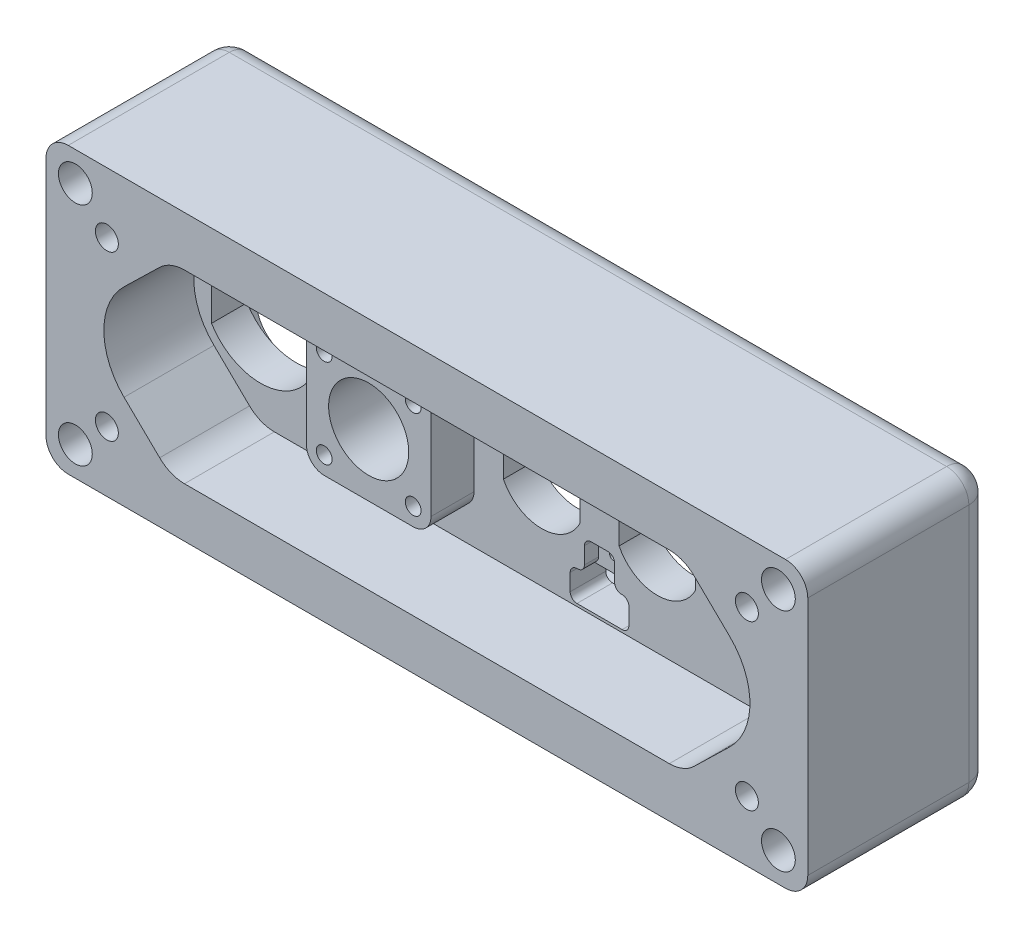
from build123d import *

# Parameters (mm, degrees)
SKETCH1_W                                            = 108.712
SKETCH1_H                                            = 40.64
BOSS_EXTRUDE1_DEPTH                                  = 26.162
CUT_EXTRUDE1_DEPTH                                   = 12.827
SKETCH3_R                                            = 5.715
CUT_EXTRUDE3_DEPTH                                   = 60.542416486
CUT_EXTRUDE4_DEPTH                                   = 60.542416486
LPATTERN1_COUNT                                      = 3
LPATTERN1_PITCH                                      = 16.51
F_1_4_0_25_DIAMETER_HOLE1_D                          = 4.826
F_1_4_0_25_DIAMETER_HOLE1_DEPTH                      = 3.81
F_1_4_0_25_DIAMETER_HOLE1_TIP                        = 1.449876674
CUT_EXTRUDE5_DEPTH                                   = 8.255
CBORE_FOR_1_4_BINDING_HEAD_MACHINE_SCREW_D           = 3.2766
CBORE_FOR_1_4_BINDING_HEAD_MACHINE_SCREW_CBORE_D     = 5.5626
CBORE_FOR_1_4_BINDING_HEAD_MACHINE_SCREW_CBORE_DEPTH = 2.8448
CUT_EXTRUDE6_DEPTH                                   = 60.542416486
CUT_EXTRUDE7_DEPTH                                   = 2.032
F_0_80_TAPPED_HOLE1_D                                = 1.19126
F_0_80_TAPPED_HOLE1_DEPTH                            = 1.524
F_0_80_TAPPED_HOLE1_TIP                              = 0.357890611
BOSS_EXTRUDE2_START                                  = 6.1468
SKETCH17_R                                           = 5.715
BOSS_EXTRUDE2_DEPTH                                  = 6.1468
F_4_40_TAPPED_HOLE4_D                                = 2.2606
F_4_40_TAPPED_HOLE4_DEPTH                            = 3.048
F_4_40_TAPPED_HOLE4_TIP                              = 0.679152758
CUT_EXTRUDE8_DEPTH                                   = 1.27
BOSS_EXTRUDE3_DEPTH                                  = 0.508
FILLET1_R                                            = 3.175


with BuildPart() as part:
    # Sketch1 → Boss-Extrude1 (new body)
    with BuildSketch(Plane.XY):
        Rectangle(SKETCH1_W, SKETCH1_H)
    extrude(amount=BOSS_EXTRUDE1_DEPTH)

    # Sketch2 → Cut-Extrude1 (cut)
    with BuildSketch(Plane.XY.offset(26.162)):
        with BuildLine():
            Line((-43.217293342, -6.827799627), (-38.136823116, -11.769493134))
            ThreePointArc((-38.136823116, -11.769493134), (-36.50629351, -12.834654073), (-34.5948, -13.208))
            Line((-34.5948, -13.208), (34.5948, -13.208))
            ThreePointArc((34.5948, -13.208), (36.50629351, -12.834654073), (38.136823116, -11.769493134))
            Line((38.136823116, -11.769493134), (43.217293342, -6.827799627))
            ThreePointArc((43.217293342, -6.827799627), (46.101, 0), (43.217293342, 6.827799627))
            Line((43.217293342, 6.827799627), (38.136823116, 11.769493134))
            ThreePointArc((38.136823116, 11.769493134), (36.50629351, 12.834654073), (34.5948, 13.208))
            Line((34.5948, 13.208), (-34.5948, 13.208))
            ThreePointArc((-34.5948, 13.208), (-36.50629351, 12.834654073), (-38.136823116, 11.769493134))
            Line((-38.136823116, 11.769493134), (-43.217293342, 6.827799627))
            ThreePointArc((-43.217293342, 6.827799627), (-46.101, 0), (-43.217293342, -6.827799627))
        make_face()
    extrude(amount=-CUT_EXTRUDE1_DEPTH, mode=Mode.SUBTRACT)

    # Sketch3 → Cut-Extrude3 (cut, through all)
    with BuildSketch(Plane.XY.offset(13.335)):
        with BuildLine():
            ThreePointArc((-29.591, 4.27907084), (-36.576, 8.1915), (-43.561, 4.27907084))
            Line((-43.561, 4.27907084), (-43.561, -4.27907084))
            ThreePointArc((-43.561, -4.27907084), (-36.576, -8.1915), (-29.591, -4.27907084))
            Line((-29.591, -4.27907084), (-29.591, 4.27907084))
        make_face()
        with Locations((-14.986, 0)):
            Circle(SKETCH3_R)
    extrude(amount=-CUT_EXTRUDE3_DEPTH, mode=Mode.SUBTRACT)

    # Sketch3<4> → Cut-Extrude4 (cut, through all)
    with BuildSketch(Plane.XY.offset(13.335)):
        with BuildLine():
            ThreePointArc((9.017, 2.709002584), (3.556, 6.096), (-1.905, 2.709002584))
            Line((-1.905, 2.709002584), (-1.905, -2.709002584))
            ThreePointArc((-1.905, -2.709002584), (3.556, -6.096), (9.017, -2.709002584))
            Line((9.017, -2.709002584), (9.017, 2.709002584))
        make_face()
    cut_extrude4 = extrude(amount=-CUT_EXTRUDE4_DEPTH, mode=Mode.SUBTRACT)

    # LPattern1: Cut-Extrude4 ×3
    with Locations(*[(i * LPATTERN1_PITCH, 0, 0) for i in range(1, LPATTERN1_COUNT)]):
        add(cut_extrude4, mode=Mode.SUBTRACT)

    # 1/4 (0.25) Diameter Hole1
    with Locations(Plane.XY.offset(26.162)):
        with Locations((-50.165, 16.129), (-50.165, -16.129), (50.165, -16.129), (50.165, 16.129)):
            Hole(F_1_4_0_25_DIAMETER_HOLE1_D / 2, depth=F_1_4_0_25_DIAMETER_HOLE1_DEPTH)
            with Locations((0, 0, -(F_1_4_0_25_DIAMETER_HOLE1_DEPTH + F_1_4_0_25_DIAMETER_HOLE1_TIP / 2))):  # 118° drill point
                Cone(0, F_1_4_0_25_DIAMETER_HOLE1_D / 2, F_1_4_0_25_DIAMETER_HOLE1_TIP, mode=Mode.SUBTRACT)

    # Sketch8 → Cut-Extrude5 (cut)
    with BuildSketch(Plane(origin=(0, 0, 0), x_dir=(-1, 0, 0), z_dir=(0, 0, -1))):
        with BuildLine():
            Line((-45.466, -16.51), (45.466, -16.51))
            ThreePointArc((45.466, -16.51), (49.058102448, -15.022102448), (50.546, -11.43))
            Line((50.546, -11.43), (50.546, 11.43))
            ThreePointArc((50.546, 11.43), (49.058102448, 15.022102448), (45.466, 16.51))
            Line((45.466, 16.51), (-45.466, 16.51))
            ThreePointArc((-45.466, 16.51), (-49.058102448, 15.022102448), (-50.546, 11.43))
            Line((-50.546, 11.43), (-50.546, -11.43))
            ThreePointArc((-50.546, -11.43), (-49.058102448, -15.022102448), (-45.466, -16.51))
        make_face()
    extrude(amount=-CUT_EXTRUDE5_DEPTH, mode=Mode.SUBTRACT)

    # CBORE for 1/4 Binding Head Machine Screw1 (through all)
    with Locations(Plane(origin=(0, 0, 8.255), x_dir=(-1, 0, 0), z_dir=(0, 0, -1))):
        with Locations((-45.6692, 11.684), (-45.6692, -11.684), (45.6692, -11.684), (45.6692, 11.684)):
            CounterBoreHole(CBORE_FOR_1_4_BINDING_HEAD_MACHINE_SCREW_D / 2, CBORE_FOR_1_4_BINDING_HEAD_MACHINE_SCREW_CBORE_D / 2, CBORE_FOR_1_4_BINDING_HEAD_MACHINE_SCREW_CBORE_DEPTH)

    # Sketch12 → Cut-Extrude6 (cut, through all)
    with BuildSketch(Plane.XY.offset(13.335)):
        with BuildLine():
            Line((15.0368, -8.509), (14.9352, -8.509))
            Line((14.9352, -8.509), (8.6868, -8.509))
            Line((8.6868, -8.509), (8.5852, -8.509))
            ThreePointArc((8.5852, -8.509), (7.902700535, -8.791700535), (7.62, -9.4742))
            Line((7.62, -9.4742), (7.62, -11.8618))
            ThreePointArc((7.62, -11.8618), (7.902700535, -12.544299465), (8.5852, -12.827))
            Line((8.5852, -12.827), (15.0368, -12.827))
            ThreePointArc((15.0368, -12.827), (15.719299465, -12.544299465), (16.002, -11.8618))
            Line((16.002, -11.8618), (16.002, -9.4742))
            ThreePointArc((16.002, -9.4742), (15.719299465, -8.791700535), (15.0368, -8.509))
        make_face()
    extrude(amount=-CUT_EXTRUDE6_DEPTH, mode=Mode.SUBTRACT)

    # Sketch12<3> → Cut-Extrude7 (cut)
    with BuildSketch(Plane.XY.offset(13.335)):
        with BuildLine():
            Line((8.6868, -8.509), (14.9352, -8.509))
            ThreePointArc((14.9352, -8.509), (14.252700535, -8.226299465), (13.97, -7.5438))
            Line((13.97, -7.5438), (13.97, -5.1562))
            ThreePointArc((13.97, -5.1562), (13.687299465, -4.473700535), (13.0048, -4.191))
            Line((13.0048, -4.191), (10.6172, -4.191))
            ThreePointArc((10.6172, -4.191), (9.934700535, -4.473700535), (9.652, -5.1562))
            Line((9.652, -5.1562), (9.652, -7.5438))
            ThreePointArc((9.652, -7.5438), (9.369299465, -8.226299465), (8.6868, -8.509))
        make_face()
    extrude(amount=-CUT_EXTRUDE7_DEPTH, mode=Mode.SUBTRACT)

    # #0-80 Tapped Hole1
    with Locations(Plane.XY.offset(11.303)):
        with Locations((11.811, -6.35)):
            Hole(F_0_80_TAPPED_HOLE1_D / 2, depth=F_0_80_TAPPED_HOLE1_DEPTH)
            with Locations((0, 0, -(F_0_80_TAPPED_HOLE1_DEPTH + F_0_80_TAPPED_HOLE1_TIP / 2))):  # 118° drill point
                Cone(0, F_0_80_TAPPED_HOLE1_D / 2, F_0_80_TAPPED_HOLE1_TIP, mode=Mode.SUBTRACT)

    # Sketch17 → Boss-Extrude2 (add)
    with BuildSketch(Plane.XY.offset(13.335).offset(BOSS_EXTRUDE2_START)):
        with BuildLine():
            Line((-21.336, -8.89), (-8.636, -8.89))
            ThreePointArc((-8.636, -8.89), (-6.839948776, -8.146051224), (-6.096, -6.35))
            Line((-6.096, -6.35), (-6.096, 6.35))
            ThreePointArc((-6.096, 6.35), (-6.839948776, 8.146051224), (-8.636, 8.89))
            Line((-8.636, 8.89), (-21.336, 8.89))
            ThreePointArc((-21.336, 8.89), (-23.132051224, 8.146051224), (-23.876, 6.35))
            Line((-23.876, 6.35), (-23.876, -6.35))
            ThreePointArc((-23.876, -6.35), (-23.132051224, -8.146051224), (-21.336, -8.89))
        make_face()
        with Locations((-14.986, 0)):
            Circle(SKETCH17_R, mode=Mode.SUBTRACT)
    extrude(amount=-BOSS_EXTRUDE2_DEPTH)

    # #4-40 Tapped Hole4
    with Locations(Plane.XY.offset(19.4818)):
        with Locations((-21.336, 6.35), (-8.636, 6.35), (-8.636, -6.35), (-21.336, -6.35)):
            Hole(F_4_40_TAPPED_HOLE4_D / 2, depth=F_4_40_TAPPED_HOLE4_DEPTH)
            with Locations((0, 0, -(F_4_40_TAPPED_HOLE4_DEPTH + F_4_40_TAPPED_HOLE4_TIP / 2))):  # 118° drill point
                Cone(0, F_4_40_TAPPED_HOLE4_D / 2, F_4_40_TAPPED_HOLE4_TIP, mode=Mode.SUBTRACT)

    # Sketch22 → Cut-Extrude8 (cut)
    with BuildSketch(Plane(origin=(0, 0, 8.255), x_dir=(-1, 0, 0), z_dir=(0, 0, -1))):
        with BuildLine():
            Line((-41.0464, 8.5852), (1.1684, 8.5852))
            ThreePointArc((1.1684, 8.5852), (2.317872783, 9.061327217), (2.794, 10.2108))
            Line((2.794, 10.2108), (2.794, 13.0048))
            ThreePointArc((2.794, 13.0048), (2.317872783, 14.154272783), (1.1684, 14.6304))
            Line((1.1684, 14.6304), (-41.0464, 14.6304))
            ThreePointArc((-41.0464, 14.6304), (-42.195872783, 14.154272783), (-42.672, 13.0048))
            Line((-42.672, 13.0048), (-42.672, 10.2108))
            ThreePointArc((-42.672, 10.2108), (-42.195872783, 9.061327217), (-41.0464, 8.5852))
        make_face()
    extrude(amount=-CUT_EXTRUDE8_DEPTH, mode=Mode.SUBTRACT)

    # Sketch23 → Boss-Extrude3 (add)
    # profile 1 of 11: a face of its own
    with BuildSketch(Plane(origin=(0, 0, 9.525), x_dir=(-1, 0, 0), z_dir=(0, 0, -1))):
        with BuildLine():
            Line((-40.979603187, 13.31666409), (-40.356941929, 13.31666409))
            add(Edge.make_bspline(
                [(-40.356941929, 13.31666409), (-40.314114893, 13.316617012), (-40.232056389, 13.31652681), (-40.114386303, 13.313792005), (-40.007516047, 13.31013922), (-39.911676058, 13.305075645), (-39.826571455, 13.299091596), (-39.752587333, 13.290698674), (-39.689142164, 13.281935406), (-39.651127028, 13.273025987), (-39.633789886, 13.268962767)],
                knots=[0, 0, 0, 0, 1.415646017, 2.712440637, 3.8905458, 4.950247383, 5.884950622, 6.709939814, 7.411656543, 8, 8, 8, 8], degree=3))
            add(Edge.make_bspline(
                [(-39.633789886, 13.268962767), (-39.611842895, 13.262955713), (-39.568466065, 13.251083153), (-39.505962976, 13.227303561), (-39.446496273, 13.199107597), (-39.389861931, 13.166973023), (-39.336755899, 13.129521118), (-39.286385847, 13.08827005), (-39.239196294, 13.042267413), (-39.195452602, 12.992029171), (-39.155279965, 12.938398695), (-39.120690895, 12.880575386), (-39.091728339, 12.819532561), (-39.0668878, 12.755312678), (-39.049009417, 12.687376456), (-39.035541157, 12.616195939), (-39.026992581, 12.541778755), (-39.026173829, 12.490924447), (-39.025757033, 12.465036485)],
                knots=[0, 0, 0, 0, 0.999701418, 1.975846123, 2.934577507, 3.890451536, 4.834027766, 5.787354733, 6.749476667, 7.726910423, 8.712836071, 9.690891519, 10.682875813, 11.679750201, 12.712814741, 13.765529915, 14.8625177, 16, 16, 16, 16], degree=3))
            add(Edge.make_bspline(
                [(-39.025757033, 12.465036485), (-39.026139326, 12.438930931), (-39.026887307, 12.38785365), (-39.035864651, 12.313129763), (-39.047957039, 12.241720938), (-39.066550794, 12.173785508), (-39.090903655, 12.109726916), (-39.119471445, 12.048566227), (-39.153927934, 11.991343953), (-39.193520029, 11.937852354), (-39.237563261, 11.888041219), (-39.285871284, 11.842271513), (-39.33824907, 11.800811149), (-39.394530162, 11.76356718), (-39.455263239, 11.731403269), (-39.519527193, 11.702594857), (-39.587880603, 11.678400395), (-39.635181312, 11.665673125), (-39.659230591, 11.65920215)],
                knots=[0, 0, 0, 0, 1.121902311, 2.195077645, 3.232258892, 4.234102512, 5.217864754, 6.176164875, 7.132989551, 8.084763148, 9.034132444, 9.988522005, 10.94243251, 11.903244335, 12.886203696, 13.894208494, 14.929344452, 16, 16, 16, 16], degree=3))
            add(Edge.make_bspline(
                [(-39.659230591, 11.65920215), (-39.679121815, 11.654972161), (-39.72271459, 11.645701892), (-39.794508345, 11.635352791), (-39.878097374, 11.626519396), (-39.973367585, 11.619896222), (-40.080233463, 11.614226245), (-40.198752818, 11.609719474), (-40.329158302, 11.607243106), (-40.420118645, 11.607115387), (-40.467608996, 11.607048705)],
                knots=[0, 0, 0, 0, 0.601384939, 1.31797006, 2.144135048, 3.087295005, 4.142315834, 5.309527816, 6.595305764, 8, 8, 8, 8], degree=3))
            Line((-40.467608996, 11.607048705), (-40.69466729, 11.607048705))
            Line((-40.69466729, 11.607048705), (-40.69466729, 10.14166409))
            Line((-40.69466729, 10.14166409), (-40.979603187, 10.14166409))
            Line((-40.979603187, 10.14166409), (-40.979603187, 13.31666409))
        make_face()
        with BuildLine():
            Line((-40.69466729, 12.991023064), (-40.69466729, 11.932689731))
            Line((-40.69466729, 11.932689731), (-40.138787883, 11.925693537))
            add(Edge.make_bspline(
                [(-40.138787883, 11.925693537), (-40.111646236, 11.925679509), (-40.059249846, 11.925652429), (-39.983561272, 11.929267596), (-39.91333999, 11.933440936), (-39.848801696, 11.939551381), (-39.789917299, 11.948188522), (-39.736588612, 11.956907741), (-39.689229148, 11.969521892), (-39.633803444, 11.98650639), (-39.572042121, 12.015473834), (-39.504852274, 12.057519806), (-39.447910385, 12.111114448), (-39.39863593, 12.171373981), (-39.35953274, 12.238411048), (-39.330906947, 12.31013787), (-39.314087469, 12.385818847), (-39.311832136, 12.437605945), (-39.310692931, 12.46376445)],
                knots=[0, 0, 0, 0, 1.160613943, 2.240541288, 3.23993089, 4.169200891, 5.011653406, 5.7853311, 6.478053781, 7.106038997, 8.262395093, 9.384106736, 10.481365981, 11.59014053, 12.70357646, 13.786202915, 14.881775077, 16, 16, 16, 16], degree=3))
            add(Edge.make_bspline(
                [(-39.310692931, 12.46376445), (-39.311838332, 12.489290102), (-39.314115246, 12.540031938), (-39.331038779, 12.614398385), (-39.359477086, 12.685369345), (-39.398898425, 12.751566358), (-39.446742164, 12.811609059), (-39.502349426, 12.863767167), (-39.565589313, 12.905696855), (-39.624415922, 12.932759903), (-39.676668427, 12.94928376), (-39.722054562, 12.960845151), (-39.773299674, 12.970075879), (-39.830420445, 12.977550286), (-39.892974144, 12.983948783), (-39.961498187, 12.988290348), (-40.035732992, 12.990831669), (-40.087268296, 12.990957721), (-40.113983195, 12.991023064)],
                knots=[0, 0, 0, 0, 1.120700087, 2.227813068, 3.331159281, 4.466773991, 5.599788987, 6.693661531, 7.80175334, 8.91857717, 9.525282508, 10.207424825, 10.974604443, 11.810962634, 12.737642355, 13.736264703, 14.826523623, 16, 16, 16, 16], degree=3))
            Line((-40.113983195, 12.991023064), (-40.69466729, 12.991023064))
        make_face(mode=Mode.SUBTRACT)
    # profile 2 of 11: a face of its own
    with BuildSketch(Plane(origin=(0, 0, 9.525), x_dir=(-1, 0, 0), z_dir=(0, 0, -1))):
        Polygon((-38.578000623, 13.31666409), (-38.283524461, 13.31666409), (-37.662135238, 10.988203553), (-36.738001625, 13.31666409), (-36.696660479, 13.31666409), (-35.789699341, 11.004103993), (-35.16513003, 13.31666409), (-34.873833956, 13.31666409), (-35.729913684, 10.14166409), (-35.770618812, 10.14166409), (-36.72591729, 12.569979394), (-37.692664085, 10.14166409), (-37.733369213, 10.14166409), align=None)
    # profile 3 of 11: a face of its own
    with BuildSketch(Plane(origin=(0, 0, 9.525), x_dir=(-1, 0, 0), z_dir=(0, 0, -1))):
        with BuildLine():
            Line((-34.303962162, 13.31666409), (-33.668580551, 13.31666409))
            add(Edge.make_bspline(
                [(-33.668580551, 13.31666409), (-33.62617967, 13.316522951), (-33.544765282, 13.316251949), (-33.428130958, 13.314740864), (-33.322152092, 13.310409841), (-33.226884094, 13.306682769), (-33.142328715, 13.299886508), (-33.068226672, 13.293390778), (-33.004919261, 13.284887529), (-32.966596239, 13.276990467), (-32.949244613, 13.273414891)],
                knots=[0, 0, 0, 0, 1.410062039, 2.707475311, 3.878576406, 4.937260626, 5.877586885, 6.699081471, 7.410979367, 8, 8, 8, 8], degree=3))
            add(Edge.make_bspline(
                [(-32.949244613, 13.273414891), (-32.926015747, 13.267675611), (-32.88005355, 13.256319485), (-32.813877418, 13.232316847), (-32.750817996, 13.204540474), (-32.691137227, 13.171916242), (-32.635134045, 13.134201977), (-32.582231006, 13.092048752), (-32.53218805, 13.045687215), (-32.487028999, 12.993948466), (-32.444448574, 12.939668204), (-32.408536034, 12.880972653), (-32.377578442, 12.819593981), (-32.352930901, 12.754907967), (-32.333084454, 12.687541931), (-32.319090651, 12.616885665), (-32.310698502, 12.543261066), (-32.309844105, 12.493043535), (-32.30941088, 12.467580556)],
                knots=[0, 0, 0, 0, 1.027469482, 2.033020251, 3.019912614, 3.986113645, 4.951240523, 5.91722682, 6.890402269, 7.87763091, 8.8651537, 9.85103654, 10.82876324, 11.815024772, 12.821070561, 13.842952187, 14.906261191, 16, 16, 16, 16], degree=3))
            add(Edge.make_bspline(
                [(-32.30941088, 12.467580556), (-32.310743471, 12.425275854), (-32.313343701, 12.342728423), (-32.337587188, 12.222930338), (-32.377298745, 12.111180031), (-32.432020586, 12.007618209), (-32.501706825, 11.914263552), (-32.585458599, 11.832266497), (-32.683322633, 11.76365029), (-32.774426369, 11.716068103), (-32.854902822, 11.685594536), (-32.92115447, 11.664152982), (-32.993423799, 11.64758677), (-33.071018382, 11.632745794), (-33.154261126, 11.621541042), (-33.242952519, 11.613334489), (-33.337155814, 11.608205459), (-33.401870541, 11.60744164), (-33.435162081, 11.607048705)],
                knots=[0, 0, 0, 0, 1.260483769, 2.459530307, 3.627416485, 4.787058657, 5.939039949, 7.08810263, 8.267026773, 9.491475466, 10.141966685, 10.831826277, 11.566392101, 12.351337768, 13.187381173, 14.07005841, 15.007169909, 16, 16, 16, 16], degree=3))
            Line((-33.435162081, 11.607048705), (-32.268705751, 10.14166409))
            Line((-32.268705751, 10.14166409), (-32.621059517, 10.14166409))
            Line((-32.621059517, 10.14166409), (-33.787515847, 11.607048705))
            Line((-33.787515847, 11.607048705), (-34.019026264, 11.607048705))
            Line((-34.019026264, 11.607048705), (-34.019026264, 10.14166409))
            Line((-34.019026264, 10.14166409), (-34.303962162, 10.14166409))
            Line((-34.303962162, 10.14166409), (-34.303962162, 13.31666409))
        make_face()
        with BuildLine():
            Line((-34.019026264, 12.991023064), (-34.019026264, 11.932689731))
            Line((-34.019026264, 11.932689731), (-33.437706152, 11.928237607))
            add(Edge.make_bspline(
                [(-33.437706152, 11.928237607), (-33.410564402, 11.9282256), (-33.357955961, 11.928202326), (-33.281846072, 11.931825251), (-33.210979971, 11.93594669), (-33.145628717, 11.942250739), (-33.085763117, 11.950375176), (-33.031413092, 11.960537883), (-32.982489924, 11.972377968), (-32.925431964, 11.990703729), (-32.861717396, 12.01973776), (-32.792473857, 12.061979319), (-32.733507451, 12.115109877), (-32.683689104, 12.175864369), (-32.643657406, 12.242662967), (-32.615434328, 12.314704959), (-32.597525113, 12.390171623), (-32.595412789, 12.442040335), (-32.594346777, 12.468216574)],
                knots=[0, 0, 0, 0, 1.146690395, 2.22261258, 3.21895312, 4.145990853, 4.996080663, 5.770904154, 6.481378293, 7.121626537, 8.300444488, 9.431385265, 10.535395872, 11.636531494, 12.74115979, 13.810798291, 14.895190096, 16, 16, 16, 16], degree=3))
            add(Edge.make_bspline(
                [(-32.594346777, 12.468216574), (-32.595437272, 12.493749537), (-32.597598237, 12.544346553), (-32.615241048, 12.618420129), (-32.645076416, 12.688330862), (-32.685283017, 12.75379436), (-32.734267965, 12.81321742), (-32.791706266, 12.864060195), (-32.856027408, 12.906015066), (-32.916144852, 12.932825111), (-32.969878745, 12.949262407), (-33.016532793, 12.960829534), (-33.069248205, 12.970122731), (-33.128280943, 12.977568614), (-33.193378994, 12.983968457), (-33.264871513, 12.988278999), (-33.342284163, 12.990831576), (-33.39593888, 12.990957749), (-33.423713764, 12.991023064)],
                knots=[0, 0, 0, 0, 1.101028733, 2.181837193, 3.264309656, 4.369019818, 5.486613113, 6.575447106, 7.666700264, 8.788928104, 9.402425223, 10.0903467, 10.862060571, 11.710948788, 12.657782767, 13.684531032, 14.801375019, 16, 16, 16, 16], degree=3))
            Line((-33.423713764, 12.991023064), (-34.019026264, 12.991023064))
        make_face(mode=Mode.SUBTRACT)
    # profile 4 of 11: a face of its own
    with BuildSketch(Plane(origin=(0, 0, 9.525), x_dir=(-1, 0, 0), z_dir=(0, 0, -1))):
        Polygon((-24.209090367, 13.31666409), (-22.743705751, 10.14166409), (-23.053446336, 10.14166409), (-23.522827346, 11.159292295), (-24.962135238, 11.159292295), (-25.444872618, 10.14166409), (-25.755885238, 10.14166409), (-24.249795495, 13.31666409), align=None)
        Polygon((-24.232623019, 12.697818937), (-24.807582955, 11.48493332), (-23.672927506, 11.48493332), align=None, mode=Mode.SUBTRACT)
    # profile 5 of 11: a face of its own
    with BuildSketch(Plane(origin=(0, 0, 9.525), x_dir=(-1, 0, 0), z_dir=(0, 0, -1))):
        with BuildLine():
            Line((-22.173833956, 13.31666409), (-21.888898059, 13.31666409))
            Line((-21.888898059, 13.31666409), (-21.888898059, 11.414335364))
            add(Edge.make_bspline(
                [(-21.888898059, 11.414335364), (-21.888940462, 11.387410696), (-21.88902093, 11.3363165), (-21.888483436, 11.263592399), (-21.886978151, 11.198938097), (-21.886029135, 11.142104374), (-21.883917911, 11.093352025), (-21.882196112, 11.052416921), (-21.879982178, 11.019492895), (-21.877321421, 11.000278769), (-21.876177706, 10.992019658)],
                knots=[0, 0, 0, 0, 1.528628734, 2.90083645, 4.128790002, 5.200304208, 6.127813768, 6.898992206, 7.526736466, 8, 8, 8, 8], degree=3))
            add(Edge.make_bspline(
                [(-21.876177706, 10.992019658), (-21.871481012, 10.962222952), (-21.862352264, 10.904308476), (-21.839087336, 10.821841677), (-21.806595745, 10.74751814), (-21.768093842, 10.679018612), (-21.717354974, 10.618249693), (-21.656573195, 10.562268407), (-21.582933362, 10.51330827), (-21.501054099, 10.468540034), (-21.41280249, 10.432558138), (-21.32262227, 10.405349872), (-21.231868996, 10.388768298), (-21.171112046, 10.386848295), (-21.140941328, 10.385894859)],
                knots=[0, 0, 0, 0, 1.035780045, 2.013197591, 2.933192213, 3.817615948, 4.702609284, 5.640816605, 6.646850145, 7.73207398, 8.84249596, 9.914020372, 10.964143139, 12, 12, 12, 12], degree=3))
            add(Edge.make_bspline(
                [(-21.140941328, 10.385894859), (-21.115039007, 10.386868994), (-21.063383968, 10.388811639), (-20.986633849, 10.400841652), (-20.911885179, 10.422522879), (-20.838768848, 10.450498946), (-20.770233312, 10.487462832), (-20.706240333, 10.530162808), (-20.649123049, 10.58024696), (-20.597000437, 10.635673701), (-20.551611602, 10.698211948), (-20.512267781, 10.766499973), (-20.480040688, 10.841565452), (-20.464126205, 10.894319821), (-20.455950343, 10.921421702)],
                knots=[0, 0, 0, 0, 0.994687771, 1.983630487, 2.973142513, 3.978332533, 4.983357753, 5.956394766, 6.925816176, 7.893390482, 8.871859704, 9.88551698, 10.913711441, 12, 12, 12, 12], degree=3))
            add(Edge.make_bspline(
                [(-20.455950343, 10.921421702), (-20.4532288, 10.932623623), (-20.447164108, 10.957586017), (-20.441497145, 10.999787474), (-20.435594797, 11.049579968), (-20.431499437, 11.107321255), (-20.427506902, 11.172817852), (-20.425118328, 11.246410957), (-20.424014306, 11.327833343), (-20.423685303, 11.384654197), (-20.423513444, 11.414335364)],
                knots=[0, 0, 0, 0, 0.558680831, 1.244966039, 2.062412453, 2.990489873, 4.051219941, 5.244515665, 6.560634259, 8, 8, 8, 8], degree=3))
            Line((-20.423513444, 11.414335364), (-20.423513444, 13.31666409))
            Line((-20.423513444, 13.31666409), (-20.138577546, 13.31666409))
            Line((-20.138577546, 13.31666409), (-20.138577546, 11.399070941))
            add(Edge.make_bspline(
                [(-20.138577546, 11.399070941), (-20.13880807, 11.364510268), (-20.13925795, 11.297063015), (-20.143159188, 11.198228568), (-20.149379466, 11.104472649), (-20.158167946, 11.015782656), (-20.169812941, 10.932475954), (-20.182762606, 10.853822343), (-20.199254039, 10.780386414), (-20.218515768, 10.711595578), (-20.240535343, 10.646113005), (-20.269056956, 10.583965905), (-20.301192039, 10.523264985), (-20.339305331, 10.464928343), (-20.382132799, 10.408697684), (-20.43062111, 10.354914023), (-20.483166599, 10.302717889), (-20.54064277, 10.253448179), (-20.602102176, 10.208264593), (-20.667361994, 10.168533758), (-20.735920921, 10.134948048), (-20.807600743, 10.107302031), (-20.882432048, 10.086515216), (-20.960416724, 10.07102561), (-21.041732278, 10.06222424), (-21.097035931, 10.060916204), (-21.125040888, 10.060253833)],
                knots=[0, 0, 0, 0, 1.316592851, 2.569410997, 3.76748051, 4.895814652, 5.963796859, 6.97159953, 7.931736103, 8.829262218, 9.692595152, 10.560224239, 11.431080259, 12.30701507, 13.211635791, 14.121146779, 15.063487852, 16.031507147, 17.00238618, 17.966455255, 18.938106653, 19.907068911, 20.888905087, 21.893141452, 22.933117798, 24, 24, 24, 24], degree=3))
            add(Edge.make_bspline(
                [(-21.125040888, 10.060253833), (-21.155583573, 10.060965727), (-21.215508214, 10.062362461), (-21.303807746, 10.070365956), (-21.388457053, 10.085441214), (-21.47035017, 10.104636306), (-21.548372164, 10.131110124), (-21.62356836, 10.162041995), (-21.694650878, 10.200030652), (-21.762772887, 10.242297516), (-21.826113916, 10.289854152), (-21.884259418, 10.341688453), (-21.937305386, 10.396970081), (-21.984357703, 10.456297555), (-22.026195934, 10.519209461), (-22.062236914, 10.585883771), (-22.093182499, 10.656294673), (-22.109154171, 10.705237933), (-22.117228388, 10.729980396)],
                knots=[0, 0, 0, 0, 1.13879206, 2.234305948, 3.301075583, 4.341971843, 5.366689343, 6.369221514, 7.369726634, 8.367512178, 9.355451585, 10.318319045, 11.268648973, 12.207971039, 13.137398894, 14.081662264, 15.030215811, 16, 16, 16, 16], degree=3))
            add(Edge.make_bspline(
                [(-22.117228388, 10.729980396), (-22.12192481, 10.746882802), (-22.132111454, 10.783544499), (-22.143020116, 10.8442201), (-22.152190498, 10.914083632), (-22.160813397, 10.993139879), (-22.165901523, 11.081450115), (-22.170362342, 11.17897606), (-22.173865382, 11.28583564), (-22.173844725, 11.360270807), (-22.173833956, 11.399070941)],
                knots=[0, 0, 0, 0, 0.625038921, 1.35572334, 2.194682327, 3.136881307, 4.189498639, 5.346923369, 6.617055217, 8, 8, 8, 8], degree=3))
            Line((-22.173833956, 11.399070941), (-22.173833956, 13.31666409))
        make_face()
    # profile 6 of 11: a face of its own
    with BuildSketch(Plane(origin=(0, 0, 9.525), x_dir=(-1, 0, 0), z_dir=(0, 0, -1))):
        with BuildLine():
            Line((-19.324474982, 10.14166409), (-19.324474982, 13.31666409))
            Line((-19.324474982, 13.31666409), (-18.683369213, 13.31666409))
            add(Edge.make_bspline(
                [(-18.683369213, 13.31666409), (-18.627608059, 13.316262615), (-18.519877801, 13.315486969), (-18.364200795, 13.310568993), (-18.220161239, 13.30186907), (-18.08823286, 13.289196715), (-17.968053474, 13.273636463), (-17.859959594, 13.254132524), (-17.763392293, 13.231101827), (-17.704002158, 13.211466311), (-17.67591729, 13.202180917)],
                knots=[0, 0, 0, 0, 1.314313732, 2.53924729, 3.670748893, 4.714932338, 5.66265055, 6.526160246, 7.303039223, 8, 8, 8, 8], degree=3))
            add(Edge.make_bspline(
                [(-17.67591729, 13.202180917), (-17.639182776, 13.188183062), (-17.566546766, 13.160504778), (-17.463126019, 13.108292991), (-17.365766583, 13.049135391), (-17.273946359, 12.982954001), (-17.189762752, 12.907874914), (-17.109927017, 12.827087415), (-17.037705089, 12.737653706), (-16.971566849, 12.641428538), (-16.911935215, 12.539545462), (-16.860101836, 12.432198614), (-16.817054285, 12.319933147), (-16.781319001, 12.203061262), (-16.753155429, 12.081325977), (-16.733940391, 11.954585541), (-16.721266707, 11.823340848), (-16.719993032, 11.734282584), (-16.719346777, 11.689094979)],
                knots=[0, 0, 0, 0, 0.984719456, 1.947108742, 2.898477687, 3.838006223, 4.779231079, 5.722358779, 6.681677486, 7.655904652, 8.64651281, 9.637519902, 10.640069247, 11.656948941, 12.698408672, 13.768548281, 14.867775369, 16, 16, 16, 16], degree=3))
            add(Edge.make_bspline(
                [(-16.719346777, 11.689094979), (-16.71991734, 11.649850856), (-16.721041695, 11.572516211), (-16.731137574, 11.45854197), (-16.745811808, 11.347948945), (-16.768530473, 11.241263774), (-16.796109896, 11.137551748), (-16.831455947, 11.037918212), (-16.871946719, 10.941449185), (-16.919163394, 10.849449046), (-16.970998794, 10.762287701), (-17.026626375, 10.680122758), (-17.085986806, 10.604126664), (-17.14964613, 10.53406928), (-17.216781701, 10.470056219), (-17.287833058, 10.411552748), (-17.36298354, 10.359703588), (-17.441896553, 10.312471283), (-17.526874184, 10.271268532), (-17.619526006, 10.236407023), (-17.720247146, 10.207517593), (-17.828790378, 10.183413995), (-17.945343247, 10.16429387), (-18.070020023, 10.151479214), (-18.20262915, 10.142813339), (-18.293687484, 10.142054611), (-18.340555711, 10.14166409)],
                knots=[0, 0, 0, 0, 1.105936401, 2.179363191, 3.223086493, 4.248585256, 5.251745608, 6.245858792, 7.225916811, 8.198733463, 9.158002045, 10.082870192, 10.993790845, 11.873723703, 12.748670949, 13.606408763, 14.465103618, 15.319838547, 16.196477973, 17.123216899, 18.106603292, 19.147568657, 20.255746949, 21.433717677, 22.679120308, 24, 24, 24, 24], degree=3))
            Line((-18.340555711, 10.14166409), (-19.324474982, 10.14166409))
        make_face()
        with BuildLine():
            Line((-19.039539085, 10.467305115), (-18.675100984, 10.467305115))
            add(Edge.make_bspline(
                [(-18.675100984, 10.467305115), (-18.622733104, 10.467530174), (-18.522010495, 10.467963045), (-18.377177883, 10.471761436), (-18.24484443, 10.477968051), (-18.124991347, 10.486654014), (-18.017686303, 10.498146258), (-17.922705044, 10.510959563), (-17.840358917, 10.526922964), (-17.790530071, 10.541392763), (-17.767503828, 10.548079354)],
                knots=[0, 0, 0, 0, 1.375205317, 2.645023457, 3.804390687, 4.853969522, 5.800190428, 6.637939096, 7.370582563, 8, 8, 8, 8], degree=3))
            add(Edge.make_bspline(
                [(-17.767503828, 10.548079354), (-17.7385221, 10.558286125), (-17.681250871, 10.578455878), (-17.598808744, 10.61524747), (-17.521922032, 10.658828491), (-17.449250795, 10.707271982), (-17.3818259, 10.76228657), (-17.318848309, 10.822675967), (-17.260444818, 10.888747513), (-17.207218839, 10.960419202), (-17.159586306, 11.037244945), (-17.118337405, 11.118469459), (-17.082186372, 11.203202779), (-17.053812221, 11.292746087), (-17.031573083, 11.386298876), (-17.015820831, 11.483867727), (-17.006010331, 11.585434418), (-17.004866017, 11.654515274), (-17.004282674, 11.689730997)],
                knots=[0, 0, 0, 0, 0.998632004, 1.973411704, 2.929992603, 3.868527914, 4.809262121, 5.754881198, 6.702106254, 7.672490631, 8.653608572, 9.636854334, 10.631411391, 11.644891563, 12.686317036, 13.754757253, 14.855430412, 16, 16, 16, 16], degree=3))
            add(Edge.make_bspline(
                [(-17.004282674, 11.689730997), (-17.004748299, 11.726863511), (-17.005663024, 11.799810664), (-17.017160434, 11.90684508), (-17.033962131, 12.009788242), (-17.05825876, 12.108647033), (-17.089220343, 12.203614324), (-17.127859768, 12.29416488), (-17.172007344, 12.381255011), (-17.224533943, 12.462874614), (-17.282060945, 12.54006622), (-17.345903736, 12.610782465), (-17.415048013, 12.675184438), (-17.488739627, 12.7342751), (-17.569055424, 12.785677149), (-17.654103415, 12.831657209), (-17.745131274, 12.870678768), (-17.808461362, 12.891433165), (-17.840645855, 12.901980596)],
                knots=[0, 0, 0, 0, 1.122418816, 2.205001699, 3.251619955, 4.274784885, 5.280384055, 6.268708349, 7.249350384, 8.229342522, 9.199999885, 10.157847722, 11.105861043, 12.055065948, 13.010012805, 13.98527497, 14.976112212, 16, 16, 16, 16], degree=3))
            add(Edge.make_bspline(
                [(-17.840645855, 12.901980596), (-17.867271538, 12.909343356), (-17.923885045, 12.924998603), (-18.016267988, 12.942075905), (-18.120240302, 12.957138557), (-18.236263602, 12.969891207), (-18.364205633, 12.979041849), (-18.504164792, 12.985910113), (-18.656201577, 12.990542558), (-18.761595732, 12.990858885), (-18.816296897, 12.991023064)],
                knots=[0, 0, 0, 0, 0.674548936, 1.434276114, 2.292660221, 3.240891867, 4.284742987, 5.42552168, 6.663806718, 8, 8, 8, 8], degree=3))
            Line((-18.816296897, 12.991023064), (-19.039539085, 12.991023064))
            Line((-19.039539085, 12.991023064), (-19.039539085, 10.467305115))
        make_face(mode=Mode.SUBTRACT)
    # profile 7 of 11: a face of its own
    with BuildSketch(Plane(origin=(0, 0, 9.525), x_dir=(-1, 0, 0), z_dir=(0, 0, -1))):
        Polygon((-15.67818592, 13.31666409), (-15.091141649, 13.31666409), (-15.091141649, 10.14166409), (-15.376077546, 10.14166409), (-15.376077546, 12.991023064), (-15.864539085, 12.991023064), align=None)
    # profile 8 of 11: a face of its own
    with BuildSketch(Plane(origin=(0, 0, 9.525), x_dir=(-1, 0, 0), z_dir=(0, 0, -1))):
        Polygon((-8.659731392, 13.31666409), (-7.194346777, 10.14166409), (-7.504087362, 10.14166409), (-7.973468371, 11.159292295), (-9.412776264, 11.159292295), (-9.895513644, 10.14166409), (-10.206526264, 10.14166409), (-8.700436521, 13.31666409), align=None)
        Polygon((-8.683264045, 12.697818937), (-9.25822398, 11.48493332), (-8.123568532, 11.48493332), align=None, mode=Mode.SUBTRACT)
    # profile 9 of 11: a face of its own
    with BuildSketch(Plane(origin=(0, 0, 9.525), x_dir=(-1, 0, 0), z_dir=(0, 0, -1))):
        with BuildLine():
            Line((-6.624474982, 13.31666409), (-6.339539085, 13.31666409))
            Line((-6.339539085, 13.31666409), (-6.339539085, 11.414335364))
            add(Edge.make_bspline(
                [(-6.339539085, 11.414335364), (-6.339581488, 11.387410696), (-6.339661956, 11.3363165), (-6.339124461, 11.263592399), (-6.337619177, 11.198938097), (-6.336670161, 11.142104374), (-6.334558937, 11.093352025), (-6.332837137, 11.052416921), (-6.330623204, 11.019492895), (-6.327962447, 11.000278769), (-6.326818732, 10.992019658)],
                knots=[0, 0, 0, 0, 1.528628734, 2.90083645, 4.128790002, 5.200304208, 6.127813768, 6.898992206, 7.526736466, 8, 8, 8, 8], degree=3))
            add(Edge.make_bspline(
                [(-6.326818732, 10.992019658), (-6.322122037, 10.962222952), (-6.31299329, 10.904308476), (-6.289728361, 10.821841677), (-6.257236771, 10.74751814), (-6.218734868, 10.679018612), (-6.167995999, 10.618249693), (-6.107214221, 10.562268407), (-6.033574388, 10.51330827), (-5.951695124, 10.468540034), (-5.863443516, 10.432558138), (-5.773263296, 10.405349872), (-5.682510022, 10.388768298), (-5.621753072, 10.386848295), (-5.591582354, 10.385894859)],
                knots=[0, 0, 0, 0, 1.035780045, 2.013197591, 2.933192213, 3.817615948, 4.702609284, 5.640816605, 6.646850145, 7.73207398, 8.84249596, 9.914020372, 10.964143139, 12, 12, 12, 12], degree=3))
            add(Edge.make_bspline(
                [(-5.591582354, 10.385894859), (-5.565680032, 10.386868994), (-5.514024994, 10.388811639), (-5.437274875, 10.400841652), (-5.362526205, 10.422522879), (-5.289409874, 10.450498946), (-5.220874338, 10.487462832), (-5.156881358, 10.530162808), (-5.099764075, 10.58024696), (-5.047641463, 10.635673701), (-5.002252628, 10.698211948), (-4.962908807, 10.766499973), (-4.930681713, 10.841565452), (-4.91476723, 10.894319821), (-4.906591368, 10.921421702)],
                knots=[0, 0, 0, 0, 0.994687771, 1.983630487, 2.973142513, 3.978332533, 4.983357753, 5.956394766, 6.925816176, 7.893390482, 8.871859704, 9.88551698, 10.913711441, 12, 12, 12, 12], degree=3))
            add(Edge.make_bspline(
                [(-4.906591368, 10.921421702), (-4.903869826, 10.932623623), (-4.897805133, 10.957586017), (-4.892138171, 10.999787474), (-4.886235823, 11.049579968), (-4.882140463, 11.107321255), (-4.878147927, 11.172817852), (-4.875759354, 11.246410957), (-4.874655331, 11.327833343), (-4.874326329, 11.384654197), (-4.874154469, 11.414335364)],
                knots=[0, 0, 0, 0, 0.558680831, 1.244966039, 2.062412453, 2.990489873, 4.051219941, 5.244515665, 6.560634259, 8, 8, 8, 8], degree=3))
            Line((-4.874154469, 11.414335364), (-4.874154469, 13.31666409))
            Line((-4.874154469, 13.31666409), (-4.589218572, 13.31666409))
            Line((-4.589218572, 13.31666409), (-4.589218572, 11.399070941))
            add(Edge.make_bspline(
                [(-4.589218572, 11.399070941), (-4.589449095, 11.364510268), (-4.589898976, 11.297063015), (-4.593800213, 11.198228568), (-4.600020492, 11.104472649), (-4.608808971, 11.015782656), (-4.620453967, 10.932475954), (-4.633403631, 10.853822343), (-4.649895065, 10.780386414), (-4.669156793, 10.711595578), (-4.691176369, 10.646113005), (-4.719697982, 10.583965905), (-4.751833064, 10.523264985), (-4.789946356, 10.464928343), (-4.832773825, 10.408697684), (-4.881262135, 10.354914023), (-4.933807624, 10.302717889), (-4.991283796, 10.253448179), (-5.052743201, 10.208264593), (-5.11800302, 10.168533758), (-5.186561947, 10.134948048), (-5.258241768, 10.107302031), (-5.333073074, 10.086515216), (-5.41105775, 10.07102561), (-5.492373304, 10.06222424), (-5.547676956, 10.060916204), (-5.575681913, 10.060253833)],
                knots=[0, 0, 0, 0, 1.316592851, 2.569410997, 3.76748051, 4.895814652, 5.963796859, 6.97159953, 7.931736103, 8.829262218, 9.692595152, 10.560224239, 11.431080259, 12.30701507, 13.211635791, 14.121146779, 15.063487852, 16.031507147, 17.00238618, 17.966455255, 18.938106653, 19.907068911, 20.888905087, 21.893141452, 22.933117798, 24, 24, 24, 24], degree=3))
            add(Edge.make_bspline(
                [(-5.575681913, 10.060253833), (-5.606224599, 10.060965727), (-5.66614924, 10.062362461), (-5.754448772, 10.070365956), (-5.839098079, 10.085441214), (-5.920991196, 10.104636306), (-5.99901319, 10.131110124), (-6.074209386, 10.162041995), (-6.145291903, 10.200030652), (-6.213413913, 10.242297516), (-6.276754942, 10.289854152), (-6.334900443, 10.341688453), (-6.387946411, 10.396970081), (-6.434998729, 10.456297555), (-6.47683696, 10.519209461), (-6.512877939, 10.585883771), (-6.543823525, 10.656294673), (-6.559795196, 10.705237933), (-6.567869413, 10.729980396)],
                knots=[0, 0, 0, 0, 1.13879206, 2.234305948, 3.301075583, 4.341971843, 5.366689343, 6.369221514, 7.369726634, 8.367512178, 9.355451585, 10.318319045, 11.268648973, 12.207971039, 13.137398894, 14.081662264, 15.030215811, 16, 16, 16, 16], degree=3))
            add(Edge.make_bspline(
                [(-6.567869413, 10.729980396), (-6.572565835, 10.746882802), (-6.582752479, 10.783544499), (-6.593661142, 10.8442201), (-6.602831523, 10.914083632), (-6.611454423, 10.993139879), (-6.616542549, 11.081450115), (-6.621003368, 11.17897606), (-6.624506408, 11.28583564), (-6.62448575, 11.360270807), (-6.624474982, 11.399070941)],
                knots=[0, 0, 0, 0, 0.625038921, 1.35572334, 2.194682327, 3.136881307, 4.189498639, 5.346923369, 6.617055217, 8, 8, 8, 8], degree=3))
            Line((-6.624474982, 11.399070941), (-6.624474982, 13.31666409))
        make_face()
    # profile 10 of 11: a face of its own
    with BuildSketch(Plane(origin=(0, 0, 9.525), x_dir=(-1, 0, 0), z_dir=(0, 0, -1))):
        with BuildLine():
            Line((-3.775116008, 10.14166409), (-3.775116008, 13.31666409))
            Line((-3.775116008, 13.31666409), (-3.134010238, 13.31666409))
            add(Edge.make_bspline(
                [(-3.134010238, 13.31666409), (-3.078249085, 13.316262615), (-2.970518826, 13.315486969), (-2.81484182, 13.310568993), (-2.670802265, 13.30186907), (-2.538873885, 13.289196715), (-2.4186945, 13.273636463), (-2.31060062, 13.254132524), (-2.214033319, 13.231101827), (-2.154643183, 13.211466311), (-2.126558315, 13.202180917)],
                knots=[0, 0, 0, 0, 1.314313732, 2.53924729, 3.670748893, 4.714932338, 5.66265055, 6.526160246, 7.303039223, 8, 8, 8, 8], degree=3))
            add(Edge.make_bspline(
                [(-2.126558315, 13.202180917), (-2.089823802, 13.188183062), (-2.017187792, 13.160504778), (-1.913767045, 13.108292991), (-1.816407608, 13.049135391), (-1.724587384, 12.982954001), (-1.640403777, 12.907874914), (-1.560568042, 12.827087415), (-1.488346114, 12.737653706), (-1.422207874, 12.641428538), (-1.362576241, 12.539545462), (-1.310742862, 12.432198614), (-1.267695311, 12.319933147), (-1.231960026, 12.203061262), (-1.203796454, 12.081325977), (-1.184581416, 11.954585541), (-1.171907732, 11.823340848), (-1.170634057, 11.734282584), (-1.169987803, 11.689094979)],
                knots=[0, 0, 0, 0, 0.984719456, 1.947108742, 2.898477687, 3.838006223, 4.779231079, 5.722358779, 6.681677486, 7.655904652, 8.64651281, 9.637519902, 10.640069247, 11.656948941, 12.698408672, 13.768548281, 14.867775369, 16, 16, 16, 16], degree=3))
            add(Edge.make_bspline(
                [(-1.169987803, 11.689094979), (-1.170558366, 11.649850856), (-1.171682721, 11.572516211), (-1.1817786, 11.45854197), (-1.196452833, 11.347948945), (-1.219171498, 11.241263774), (-1.246750921, 11.137551748), (-1.282096973, 11.037918212), (-1.322587744, 10.941449185), (-1.36980442, 10.849449046), (-1.421639819, 10.762287701), (-1.4772674, 10.680122758), (-1.536627831, 10.604126664), (-1.600287155, 10.53406928), (-1.667422727, 10.470056219), (-1.738474084, 10.411552748), (-1.813624566, 10.359703588), (-1.892537578, 10.312471283), (-1.97751521, 10.271268532), (-2.070167031, 10.236407023), (-2.170888171, 10.207517593), (-2.279431404, 10.183413995), (-2.395984273, 10.16429387), (-2.520661049, 10.151479214), (-2.653270176, 10.142813339), (-2.744328509, 10.142054611), (-2.791196737, 10.14166409)],
                knots=[0, 0, 0, 0, 1.105936401, 2.179363191, 3.223086493, 4.248585256, 5.251745608, 6.245858792, 7.225916811, 8.198733463, 9.158002045, 10.082870192, 10.993790845, 11.873723703, 12.748670949, 13.606408763, 14.465103618, 15.319838547, 16.196477973, 17.123216899, 18.106603292, 19.147568657, 20.255746949, 21.433717677, 22.679120308, 24, 24, 24, 24], degree=3))
            Line((-2.791196737, 10.14166409), (-3.775116008, 10.14166409))
        make_face()
        with BuildLine():
            Line((-3.49018011, 10.467305115), (-3.125742009, 10.467305115))
            add(Edge.make_bspline(
                [(-3.125742009, 10.467305115), (-3.07337413, 10.467530174), (-2.97265152, 10.467963045), (-2.827818908, 10.471761436), (-2.695485456, 10.477968051), (-2.575632372, 10.486654014), (-2.468327329, 10.498146258), (-2.37334607, 10.510959563), (-2.290999943, 10.526922964), (-2.241171096, 10.541392763), (-2.218144854, 10.548079354)],
                knots=[0, 0, 0, 0, 1.375205317, 2.645023457, 3.804390687, 4.853969522, 5.800190428, 6.637939096, 7.370582563, 8, 8, 8, 8], degree=3))
            add(Edge.make_bspline(
                [(-2.218144854, 10.548079354), (-2.189163125, 10.558286125), (-2.131891896, 10.578455878), (-2.049449769, 10.61524747), (-1.972563058, 10.658828491), (-1.899891821, 10.707271982), (-1.832466926, 10.76228657), (-1.769489335, 10.822675967), (-1.711085844, 10.888747513), (-1.657859864, 10.960419202), (-1.610227331, 11.037244945), (-1.56897843, 11.118469459), (-1.532827398, 11.203202779), (-1.504453246, 11.292746087), (-1.482214109, 11.386298876), (-1.466461856, 11.483867727), (-1.456651356, 11.585434418), (-1.455507043, 11.654515274), (-1.4549237, 11.689730997)],
                knots=[0, 0, 0, 0, 0.998632004, 1.973411704, 2.929992603, 3.868527914, 4.809262121, 5.754881198, 6.702106254, 7.672490631, 8.653608572, 9.636854334, 10.631411391, 11.644891563, 12.686317036, 13.754757253, 14.855430412, 16, 16, 16, 16], degree=3))
            add(Edge.make_bspline(
                [(-1.4549237, 11.689730997), (-1.455389325, 11.726863511), (-1.456304049, 11.799810664), (-1.46780146, 11.90684508), (-1.484603156, 12.009788242), (-1.508899786, 12.108647033), (-1.539861369, 12.203614324), (-1.578500794, 12.29416488), (-1.62264837, 12.381255011), (-1.675174968, 12.462874614), (-1.732701971, 12.54006622), (-1.796544761, 12.610782465), (-1.865689039, 12.675184438), (-1.939380653, 12.7342751), (-2.01969645, 12.785677149), (-2.104744441, 12.831657209), (-2.1957723, 12.870678768), (-2.259102388, 12.891433165), (-2.291286881, 12.901980596)],
                knots=[0, 0, 0, 0, 1.122418816, 2.205001699, 3.251619955, 4.274784885, 5.280384055, 6.268708349, 7.249350384, 8.229342522, 9.199999885, 10.157847722, 11.105861043, 12.055065948, 13.010012805, 13.98527497, 14.976112212, 16, 16, 16, 16], degree=3))
            add(Edge.make_bspline(
                [(-2.291286881, 12.901980596), (-2.317912564, 12.909343356), (-2.374526071, 12.924998603), (-2.466909013, 12.942075905), (-2.570881327, 12.957138557), (-2.686904628, 12.969891207), (-2.814846658, 12.979041849), (-2.954805818, 12.985910113), (-3.106842602, 12.990542558), (-3.212236758, 12.990858885), (-3.266937923, 12.991023064)],
                knots=[0, 0, 0, 0, 0.674548936, 1.434276114, 2.292660221, 3.240891867, 4.284742987, 5.42552168, 6.663806718, 8, 8, 8, 8], degree=3))
            Line((-3.266937923, 12.991023064), (-3.49018011, 12.991023064))
            Line((-3.49018011, 12.991023064), (-3.49018011, 10.467305115))
        make_face(mode=Mode.SUBTRACT)
    # profile 11 of 11: a face of its own
    with BuildSketch(Plane(origin=(0, 0, 9.525), x_dir=(-1, 0, 0), z_dir=(0, 0, -1))):
        with BuildLine():
            Line((-0.396590367, 12.339741013), (-0.681526264, 12.339741013))
            add(Edge.make_bspline(
                [(-0.681526264, 12.339741013), (-0.679669204, 12.377542461), (-0.676021987, 12.451783499), (-0.658942039, 12.560027328), (-0.634502815, 12.663491324), (-0.599948424, 12.761344746), (-0.557034872, 12.854452807), (-0.505572633, 12.942445679), (-0.444618212, 13.024987686), (-0.375487817, 13.101313636), (-0.300404837, 13.17133379), (-0.219391592, 13.231799617), (-0.134260746, 13.28288779), (-0.045270577, 13.325597203), (0.048582934, 13.357655491), (0.146448098, 13.381442265), (0.248754886, 13.395753664), (0.318459763, 13.397291984), (0.353910435, 13.398074346)],
                knots=[0, 0, 0, 0, 1.10065271, 2.161652631, 3.183658789, 4.190468796, 5.17591951, 6.163126047, 7.15150782, 8.156236427, 9.156009102, 10.134482811, 11.092018607, 12.041330605, 13.001268258, 13.972401359, 14.968799086, 16, 16, 16, 16], degree=3))
            add(Edge.make_bspline(
                [(0.353910435, 13.398074346), (0.38872483, 13.397259318), (0.457133874, 13.395657816), (0.556975845, 13.381904597), (0.652023819, 13.360363953), (0.742092007, 13.330142111), (0.826461794, 13.289516237), (0.905766985, 13.240714185), (0.98095172, 13.184271909), (1.048630731, 13.117820235), (1.110777346, 13.046879501), (1.164391534, 12.971144045), (1.210304904, 12.892921765), (1.248575157, 12.811616182), (1.276747511, 12.726461749), (1.298136314, 12.638698215), (1.310226182, 12.547417136), (1.312081674, 12.485634761), (1.313025018, 12.454224186)],
                knots=[0, 0, 0, 0, 1.111607364, 2.184268762, 3.212621178, 4.221274766, 5.211760367, 6.196651075, 7.1921475, 8.207485113, 9.220403448, 10.201281604, 11.166441695, 12.114753415, 13.065576456, 14.026450734, 14.996634279, 16, 16, 16, 16], degree=3))
            add(Edge.make_bspline(
                [(1.313025018, 12.454224186), (1.311488987, 12.410002936), (1.308443879, 12.322336456), (1.282395838, 12.193508688), (1.241713645, 12.068691801), (1.192730329, 11.968237248), (1.14331604, 11.887289722), (1.098786658, 11.820643111), (1.046657866, 11.74888315), (0.986170942, 11.672250137), (0.918577123, 11.590143816), (0.84326416, 11.502613787), (0.759695001, 11.410564396), (0.701040504, 11.347694315), (0.670647213, 11.315116614)],
                knots=[0, 0, 0, 0, 1.184426356, 2.348067706, 3.509069118, 4.696110526, 5.333549288, 6.050745305, 6.844228056, 7.710549037, 8.667450064, 9.695053472, 10.805634456, 12, 12, 12, 12], degree=3))
            Line((0.670647213, 11.315116614), (-0.123738804, 10.467305115))
            Line((-0.123738804, 10.467305115), (1.353730146, 10.467305115))
            Line((1.353730146, 10.467305115), (1.353730146, 10.14166409))
            Line((1.353730146, 10.14166409), (-0.803641649, 10.14166409))
            Line((-0.803641649, 10.14166409), (0.427688479, 11.455676509))
            add(Edge.make_bspline(
                [(0.427688479, 11.455676509), (0.457667634, 11.486971402), (0.515251454, 11.547082485), (0.596697077, 11.634842171), (0.66984816, 11.716257825), (0.735178223, 11.791175623), (0.791270046, 11.860691402), (0.841046999, 11.922553741), (0.880930071, 11.979480992), (0.924214751, 12.04546712), (0.966137435, 12.126032579), (1.002162215, 12.22448814), (1.024128541, 12.32584072), (1.026763642, 12.394331853), (1.02808912, 12.428783481)],
                knots=[0, 0, 0, 0, 1.329631726, 2.553950428, 3.673215718, 4.687767853, 5.603093632, 6.413772471, 7.123043292, 7.734684054, 8.834405432, 9.900288307, 10.943827018, 12, 12, 12, 12], degree=3))
            add(Edge.make_bspline(
                [(1.02808912, 12.428783481), (1.027512411, 12.450447321), (1.026375829, 12.493142589), (1.016344917, 12.555740671), (1.001186101, 12.616124466), (0.979464331, 12.674479713), (0.950792503, 12.730219698), (0.915891651, 12.783412269), (0.875623522, 12.834837259), (0.829040585, 12.883054893), (0.777867278, 12.927215701), (0.72380678, 12.966335407), (0.666611328, 12.999028029), (0.606522074, 13.025828202), (0.543706541, 13.046851583), (0.478043237, 13.061419009), (0.409713593, 13.070565262), (0.363056065, 13.071802761), (0.339282029, 13.07243332)],
                knots=[0, 0, 0, 0, 0.991446411, 1.95395049, 2.89581595, 3.838931463, 4.798493298, 5.75982156, 6.748411868, 7.785213223, 8.824556874, 9.840280684, 10.836137867, 11.835679398, 12.848801643, 13.863922112, 14.911575587, 16, 16, 16, 16], degree=3))
            add(Edge.make_bspline(
                [(0.339282029, 13.07243332), (0.314452774, 13.071784684), (0.265692216, 13.070510869), (0.194101379, 13.06160031), (0.125806423, 13.046228012), (0.060635554, 13.025203457), (-0.001521499, 12.998480345), (-0.060362453, 12.965195691), (-0.115755217, 12.925477808), (-0.16780392, 12.880446732), (-0.215759101, 12.830311122), (-0.257893053, 12.774422084), (-0.294708551, 12.713800071), (-0.326829784, 12.648608658), (-0.352915303, 12.5782563), (-0.37284809, 12.502992739), (-0.388620444, 12.423144772), (-0.393889602, 12.368004016), (-0.396590367, 12.339741013)],
                knots=[0, 0, 0, 0, 1.031018746, 2.02475058, 2.990194455, 3.934040569, 4.864654155, 5.795059489, 6.735614925, 7.690564532, 8.649604399, 9.611025574, 10.590972636, 11.591080095, 12.624614302, 13.701020113, 14.821632451, 16, 16, 16, 16], degree=3))
        make_face()
    extrude(amount=BOSS_EXTRUDE3_DEPTH)

    # Fillet1
    fillet1_edges = [part.edges().sort_by_distance(p)[0] for p in [
        (-54.356, 0, 0),
        (0, -20.32, 0),
        (54.356, 0, 0),
        (0, 20.32, 0),
        (-54.356, 20.32, 13.081),
        (-54.356, -20.32, 13.081),
        (54.356, -20.32, 13.081),
        (54.356, 20.32, 13.081),
    ]]
    fillet(fillet1_edges, radius=FILLET1_R)


solid = part.part
